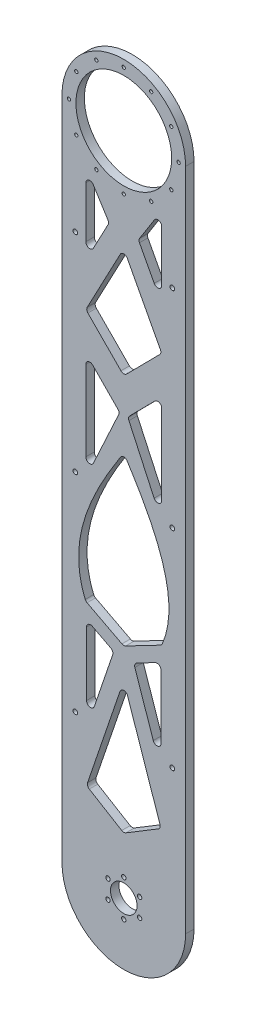
from build123d import *

# Parameters (mm, degrees)
SKETCH2_R                            = 10
SKETCH2_R_2                          = 1.65
BOSS_EXTRUDE1_DEPTH                  = 6.35
CUT_EXTRUDE1_DEPTH                   = 10
FILLET3_R                            = 3
SKETCH5_R                            = 1.75
CUT_EXTRUDE2_DEPTH                   = 549.511460792
SKETCH6_R                            = 26.5
CUT_EXTRUDE3_DEPTH                   = 10
BOSS_EXTRUDE2_START                  = -6.35
BOSS_EXTRUDE2_DEPTH                  = 6.35
TAP_DRILL_FOR_M3X0_5_TAP1_AT_2_COUNT = 2
TAP_DRILL_FOR_M3X0_5_TAP1_AT_2_PITCH = 12
CIRPATTERN2_COUNT                    = 2
CIRPATTERN2_ANGLE                    = 90
CUT_EXTRUDE4_DEPTH                   = 549.511460792
SKETCH11_R                           = 36
CUT_EXTRUDE5_DEPTH                   = 549.511460792
CUT_EXTRUDE6_DEPTH                   = 549.511460792
CUT_EXTRUDE6_DEPTH_BACK              = 549.511460792
SKETCH12_R                           = 1.25


with BuildPart() as part:
    # Sketch2 → Boss-Extrude1 (new body)
    with BuildSketch(Plane.XY):
        with BuildLine():
            Line((-46.5, 0), (-46.5, 500))
            ThreePointArc((-46.5, 500), (0, 546.5), (46.5, 500))
            Line((46.5, 500), (46.5, 0))
            ThreePointArc((46.5, 0), (0, -46.5), (-46.5, 0))
        make_face()
        Circle(SKETCH2_R, mode=Mode.SUBTRACT)
        with Locations((0, 13.75)):
            Circle(SKETCH2_R_2, mode=Mode.SUBTRACT)
        with Locations((11.907849302, 6.875)):
            Circle(SKETCH2_R_2, mode=Mode.SUBTRACT)
        with Locations((11.907849302, -6.875)):
            Circle(SKETCH2_R_2, mode=Mode.SUBTRACT)
        with Locations((0, -13.75)):
            Circle(SKETCH2_R_2, mode=Mode.SUBTRACT)
        with Locations((-11.907849302, -6.875)):
            Circle(SKETCH2_R_2, mode=Mode.SUBTRACT)
        with Locations((-11.907849302, 6.875)):
            Circle(SKETCH2_R_2, mode=Mode.SUBTRACT)
    extrude(amount=BOSS_EXTRUDE1_DEPTH)

    # Sketch4 → Cut-Extrude1 (cut)
    with BuildSketch(Plane.XY.offset(6.35)):
        Polygon((28.005258112, 59.37595418), (0, 42.411661153), (-28.005258112, 59.37595418), (0, 141.693437584), align=None)
        Polygon((-7.5, 156.905935087), (-28.005258112, 96.633637735), (-28.005258112, 167.582877854), align=None)
        Polygon((28.005258112, 167.582877854), (7.5, 156.905935087), (28.005258112, 96.633637735), align=None)
        with BuildLine():
            Line((0, 164.275138905), (28.550546746, 179.141206521))
            add(Edge.make_bspline(
                [(28.550546746, 179.141206521), (45.32025339, 216.985654627), (19.430092874, 259.790255689), (0, 290.025756679)],
                knots=[0, 0, 0, 0, 1, 1, 1, 1], degree=3))
            add(Edge.make_bspline(
                [(-28.550546746, 179.141206521), (-45.32025339, 216.985654627), (-19.430092874, 259.790255689), (0, 290.025756679)],
                knots=[0, 0, 0, 0, 1, 1, 1, 1], degree=3))
            Line((-28.550546746, 179.141206521), (0, 164.275138905))
        make_face()
        Polygon((28.550546746, 259.58677623), (3, 314.938284003), (28.550546746, 340.793051053), align=None)
        Polygon((-3, 314.938284003), (-28.550546746, 340.793051053), (-28.550546746, 259.58677623), align=None)
        Polygon((0, 423.142843498), (-28.550546746, 369.246205395), (0, 340.355718526), (28.550546746, 369.246205395), align=None)
        Polygon((-28.550546746, 462.095190817), (-28.550546746, 401.290241252), (-11, 434.421497018), align=None)
        Polygon((28.550546746, 401.290241252), (11, 434.421497018), (28.550546746, 462.095190817), align=None)
    extrude(amount=-CUT_EXTRUDE1_DEPTH, mode=Mode.SUBTRACT)

    # Fillet3
    fillet3_edges = [part.edges().sort_by_distance(p)[0] for p in [
        (-11, 434.421497018, 3.175),
        (-28.550546746, 401.290241252, 3.175),
        (28.550546746, 401.290241252, 3.175),
        (11, 434.421497018, 3.175),
        (28.550546746, 462.095190817, 3.175),
        (-28.550546746, 462.095190817, 3.175),
        (0, 423.142843498, 3.175),
        (-28.550546746, 369.246205395, 3.175),
        (28.550546746, 369.246205395, 3.175),
        (0, 340.355718526, 3.175),
        (28.550546746, 340.793051053, 3.175),
        (-28.550546746, 340.793051053, 3.175),
        (-3, 314.938284003, 3.175),
        (3, 314.938284003, 3.175),
        (28.550546746, 259.58677623, 3.175),
        (-28.550546746, 259.58677623, 3.175),
        (28.550546746, 179.141206521, 3.175),
        (0, 290.025756679, 3.175),
        (-28.550546746, 179.141206521, 3.175),
        (0, 164.275138905, 3.175),
        (-28.005258112, 96.633637735, 3.175),
        (28.005258112, 96.633637735, 3.175),
        (7.5, 156.905935087, 3.175),
        (-28.005258112, 167.582877854, 3.175),
        (28.005258112, 167.582877854, 3.175),
        (0, 141.693437584, 3.175),
        (28.005258112, 59.37595418, 3.175),
        (-28.005258112, 59.37595418, 3.175),
        (0, 42.411661153, 3.175),
        (-7.5, 156.905935087, 3.175),
    ]]
    fillet(fillet3_edges, radius=FILLET3_R)

    # Sketch5 → Cut-Extrude2 (cut, through all)
    with BuildSketch(Plane.XY.offset(6.35)):
        with Locations((36.5, 103.175)):
            Circle(SKETCH5_R)
        with Locations(Location((-36.5, 103.175, 0), (0, 0, 180))):
            Circle(SKETCH5_R)
        with Locations(Location((36.5, 259.525, 0), (0, 0, 180))):
            Circle(SKETCH5_R)
        with Locations((-36.5, 259.525)):
            Circle(SKETCH5_R)
        with Locations((36.5, 415.875)):
            Circle(SKETCH5_R)
        with Locations(Location((-36.5, 415.875, 0), (0, 0, 180))):
            Circle(SKETCH5_R)
    extrude(amount=-CUT_EXTRUDE2_DEPTH, mode=Mode.SUBTRACT)

    # Sketch6 → Cut-Extrude3 (cut)
    with BuildSketch(Plane.XY.offset(6.35)):
        with Locations((0, 500)):
            Circle(SKETCH6_R)
    extrude(amount=-CUT_EXTRUDE3_DEPTH, mode=Mode.SUBTRACT)

    # Sketch7 → Boss-Extrude2 (add)
    with BuildSketch(Plane.XY.offset(6.35).offset(BOSS_EXTRUDE2_START)):
        with BuildLine():
            Line((44.110383395, 529.968247771), (29.968247771, 544.110383395))
            ThreePointArc((29.968247771, 544.110383395), (23.286397782, 542.399293624), (16.474718596, 543.483717035))
            ThreePointArc((16.474718596, 543.483717035), (32.880465325, 532.880465325), (43.483717035, 516.474718596))
            ThreePointArc((43.483717035, 516.474718596), (42.399293624, 523.286397782), (44.110383395, 529.968247771))
        make_face()
    boss_extrude2 = extrude(amount=BOSS_EXTRUDE2_DEPTH)

    # Sketch9 → Tap Drill for M3x0.5 Tap1 (revolve, cut)
    with BuildSketch(Plane(origin=(32.796674896, 541.28195627, 3.175), x_dir=(-0.7071067811865481, 0.7071067811865469, 0), z_dir=(0, 0, 1))):
        Polygon((0, 0), (0, 5.751075774), (1.25, 5), (1.25, 0), align=None)
    tap_drill_for_m3x0_5_tap1 = revolve(axis=Axis((37.286802956, 545.772084331, 3.175), (-0.7071067811865468, -0.7071067811865482, 0)), mode=Mode.SUBTRACT)

    # Tap Drill for M3x0.5 Tap1 at 2: Tap Drill for M3x0.5 Tap1 ×2
    with Locations(*[Vector(0.7071067811865482, -0.7071067811865468, 0) * (i * TAP_DRILL_FOR_M3X0_5_TAP1_AT_2_PITCH) for i in range(1, TAP_DRILL_FOR_M3X0_5_TAP1_AT_2_COUNT)]):
        add(tap_drill_for_m3x0_5_tap1, mode=Mode.SUBTRACT)

    # CirPattern2: Boss-Extrude2, Tap Drill for M3x0.5 Tap1 ×2 about axis
    cirpattern2_axis = Axis((0, 500, 0), (0, 0, 1))
    add([boss_extrude2.rotate(cirpattern2_axis, i * CIRPATTERN2_ANGLE / (CIRPATTERN2_COUNT - 1)) for i in range(1, CIRPATTERN2_COUNT)])
    add([tap_drill_for_m3x0_5_tap1.rotate(cirpattern2_axis, i * CIRPATTERN2_ANGLE / (CIRPATTERN2_COUNT - 1)) for i in range(1, CIRPATTERN2_COUNT)], mode=Mode.SUBTRACT)

    # CirPattern2 copy 1 sketch → CirPattern2 copy 1 (revolve, cut)
    with BuildSketch(Plane(origin=(-32.796674896, 541.28195627, 3.175), x_dir=(-0.7071067811865445, -0.7071067811865506, 0), z_dir=(0, 0, 1))):
        Polygon((0, 0), (0, 5.751075774), (1.25, 5), (1.25, 0), align=None)
    revolve(axis=Axis((-37.286802956, 545.772084331, 3.175), (0.7071067811865507, -0.7071067811865444, 0)), mode=Mode.SUBTRACT)

    # Sketch10 → Cut-Extrude4 (cut, through all)
    with BuildSketch(Plane.XY.offset(6.35)):
        with BuildLine():
            Line((-43.483717035, 516.474718596), (-63.483717035, 516.474718596))
            ThreePointArc((-63.483717035, 516.474718596), (0, 565.586573942), (63.483717035, 516.474718596))
            Line((63.483717035, 516.474718596), (43.483717035, 516.474718596))
            ThreePointArc((43.483717035, 516.474718596), (0, 546.5), (-43.483717035, 516.474718596))
        make_face()
    extrude(amount=-CUT_EXTRUDE4_DEPTH, mode=Mode.SUBTRACT)

    # Sketch11 → Cut-Extrude5 (cut, through all)
    with BuildSketch(Plane.XY.offset(6.35)):
        with Locations((0, 500)):
            Circle(SKETCH11_R)
    extrude(amount=-CUT_EXTRUDE5_DEPTH, mode=Mode.SUBTRACT)

    # Sketch12 → Cut-Extrude6 (cut, two sides: drawn at the far end of the back side and taken through both)
    with BuildSketch(Plane.XY.offset(6.35).offset(-CUT_EXTRUDE6_DEPTH_BACK)):
        with Locations((0, 541.25)):
            Circle(SKETCH12_R)
        with Locations((20.625, 535.723547906)):
            Circle(SKETCH12_R)
        with Locations((35.723547906, 520.625)):
            Circle(SKETCH12_R)
        with Locations((41.25, 500)):
            Circle(SKETCH12_R)
        with Locations((35.723547906, 479.375)):
            Circle(SKETCH12_R)
        with Locations((20.625, 464.276452094)):
            Circle(SKETCH12_R)
        with Locations((0, 458.75)):
            Circle(SKETCH12_R)
        with Locations((-20.625, 464.276452094)):
            Circle(SKETCH12_R)
        with Locations((-35.723547906, 479.375)):
            Circle(SKETCH12_R)
        with Locations((-41.25, 500)):
            Circle(SKETCH12_R)
        with Locations((-35.723547906, 520.625)):
            Circle(SKETCH12_R)
        with Locations((-20.625, 535.723547906)):
            Circle(SKETCH12_R)
    extrude(amount=CUT_EXTRUDE6_DEPTH + CUT_EXTRUDE6_DEPTH_BACK, mode=Mode.SUBTRACT)


solid = part.part
